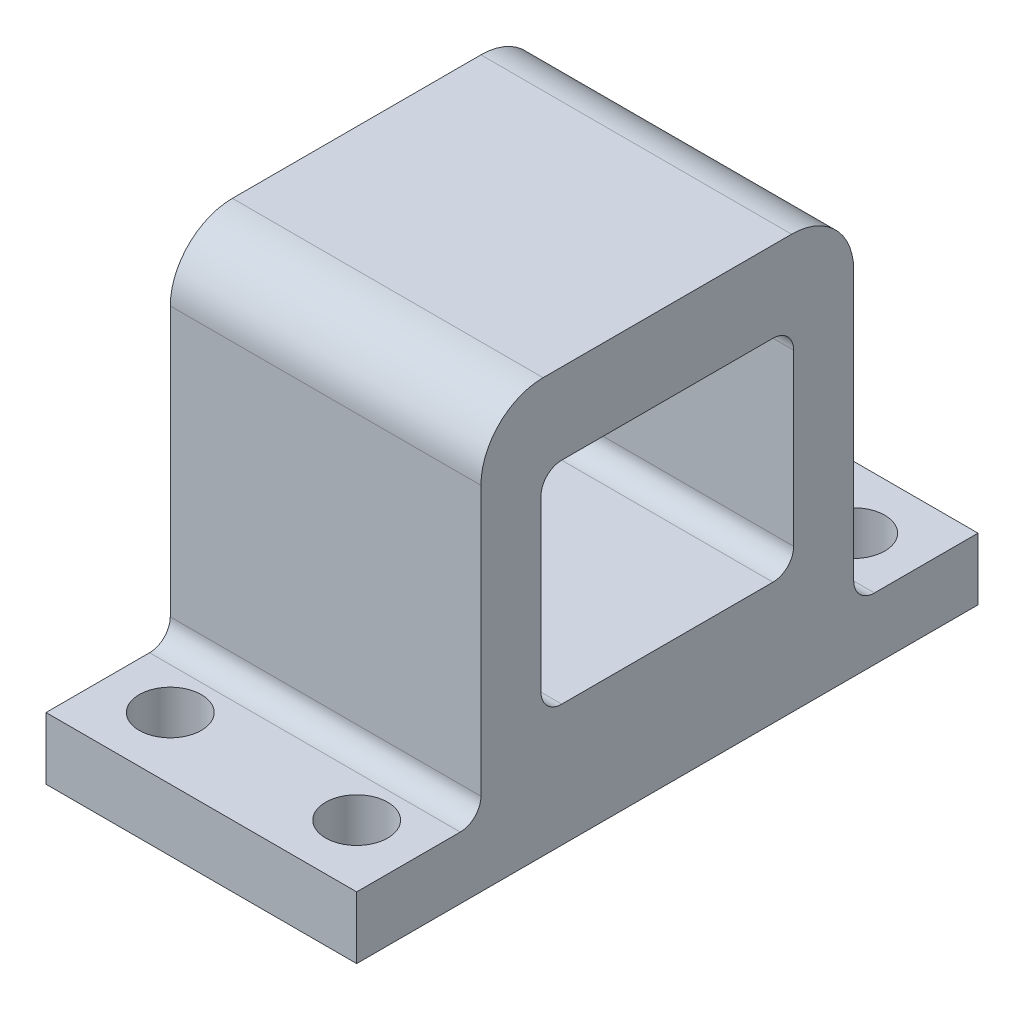
from build123d import *

# Parameters (mm, degrees)
SKETCH1_W           = 15
SKETCH1_H           = 30
BOSS_EXTRUDE2_DEPTH = 3
SKETCH3_R           = 1.5
CUT_EXTRUDE1_DEPTH  = 3
SKETCH5_W           = 15
SKETCH5_H           = 9
BOSS_EXTRUDE3_DEPTH = 17
FILLET1_R           = 1
FILLET2_R           = 1
SKETCH6_W           = 12.2
SKETCH6_H           = 10.2
CUT_EXTRUDE2_DEPTH  = 40.05124838
FILLET3_R           = 3
FILLET4_R           = 3
FILLET5_R           = 1
FILLET6_R           = 1
FILLET7_R           = 1
FILLET8_R           = 1


with BuildPart() as part:
    # Sketch1 → Boss-Extrude2 (new body)
    with BuildSketch(Plane(origin=(0, 0, 0), x_dir=(1, 0, 0), z_dir=(0, 1, 0))):
        with Locations((-7.5, 15)):
            Rectangle(SKETCH1_W, SKETCH1_H)
    extrude(amount=BOSS_EXTRUDE2_DEPTH)

    # Sketch3 → Cut-Extrude1 (cut)
    with BuildSketch(Plane(origin=(0, 3, 0), x_dir=(1, 0, 0), z_dir=(0, 1, 0))):
        with Locations(Location((-12, 27, 0), (0, 0, 270))):
            Circle(SKETCH3_R)
        with Locations(Location((-3, 27, 0), (0, 0, 270))):
            Circle(SKETCH3_R)
        with Locations(Location((-3, 3, 0), (0, 0, 270))):
            Circle(SKETCH3_R)
        with Locations(Location((-12, 3, 0), (0, 0, 270))):
            Circle(SKETCH3_R)
    extrude(amount=-CUT_EXTRUDE1_DEPTH, mode=Mode.SUBTRACT)

    # Sketch5 → Boss-Extrude3 (add)
    with BuildSketch(Plane(origin=(0, 3, 0), x_dir=(1, 0, 0), z_dir=(0, 1, 0))):
        with Locations((-7.5, 19.5)):
            Rectangle(SKETCH5_W, SKETCH5_H)
        with Locations((-7.5, 10.5)):
            Rectangle(SKETCH5_W, SKETCH5_H)
    extrude(amount=BOSS_EXTRUDE3_DEPTH)

    # Fillet1
    fillet1_edges = [part.edges().sort_by_distance(p)[0] for p in [
        (-7.5, 3, -6),
    ]]
    fillet(fillet1_edges, radius=FILLET1_R)

    # Fillet2
    fillet2_edges = [part.edges().sort_by_distance(p)[0] for p in [
        (-7.5, 3, -24),
    ]]
    fillet(fillet2_edges, radius=FILLET2_R)

    # Sketch6 → Cut-Extrude2 (cut, through all)
    with BuildSketch(Plane(origin=(0, 0, 0), x_dir=(0, 0, -1), z_dir=(1, 0, 0))):
        with Locations((15, 11)):
            Rectangle(SKETCH6_W, SKETCH6_H)
    extrude(amount=-CUT_EXTRUDE2_DEPTH, mode=Mode.SUBTRACT)

    # Fillet3
    fillet3_edges = [part.edges().sort_by_distance(p)[0] for p in [
        (-7.5, 20, -24),
    ]]
    fillet(fillet3_edges, radius=FILLET3_R)

    # Fillet4
    fillet4_edges = [part.edges().sort_by_distance(p)[0] for p in [
        (-7.5, 20, -6),
    ]]
    fillet(fillet4_edges, radius=FILLET4_R)

    # Fillet5
    fillet5_edges = [part.edges().sort_by_distance(p)[0] for p in [
        (-7.5, 5.9, -8.9),
    ]]
    fillet(fillet5_edges, radius=FILLET5_R)

    # Fillet6
    fillet6_edges = [part.edges().sort_by_distance(p)[0] for p in [
        (-7.5, 16.1, -8.9),
    ]]
    fillet(fillet6_edges, radius=FILLET6_R)

    # Fillet7
    fillet7_edges = [part.edges().sort_by_distance(p)[0] for p in [
        (-7.5, 16.1, -21.1),
    ]]
    fillet(fillet7_edges, radius=FILLET7_R)

    # Fillet8
    fillet8_edges = [part.edges().sort_by_distance(p)[0] for p in [
        (-7.5, 5.9, -21.1),
    ]]
    fillet(fillet8_edges, radius=FILLET8_R)


solid = part.part
